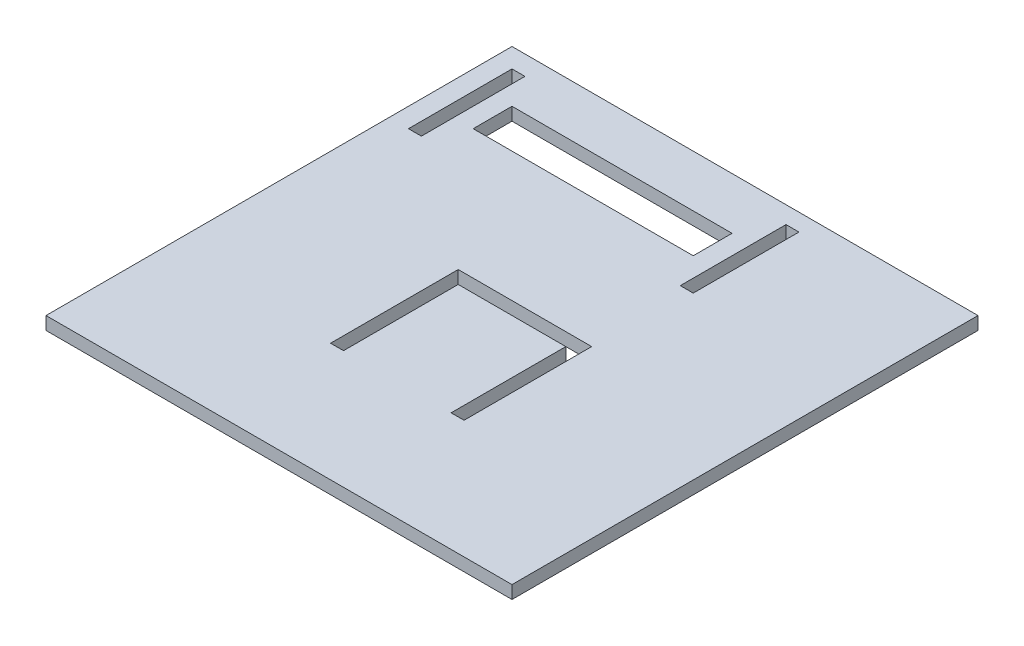
from build123d import *

# Parameters (mm, degrees)
SKETCH1_W           = 114.3
SKETCH1_H           = 114.3
SKETCH1_W_2         = 3.175
SKETCH1_H_2         = 25.4
SKETCH1_W_3         = 53.975
SKETCH1_H_3         = 9.525
SKETCH1_H_4         = 25.936362634
BOSS_EXTRUDE1_DEPTH = 3.175


with BuildPart() as part:
    # Sketch1 → Boss-Extrude1 (new body)
    with BuildSketch(Plane(origin=(0, 0, 0), x_dir=(1, 0, 0), z_dir=(0, 1, 0))):
        Rectangle(SKETCH1_W, SKETCH1_H)
        Polygon((-13.1953, 0), (-13.1953, -28.132309502), (-16.3703, -28.132309502), (-16.3703, 3.175), (-13.1953, 3.175), (13.1953, 3.175), (16.3703, 3.175), (16.3703, -28.132309502), (13.1953, -28.132309502), (13.1953, 0), align=None, mode=Mode.SUBTRACT)
        with Locations((-50.8, 39.6875)):
            Rectangle(SKETCH1_W_2, SKETCH1_H_2, mode=Mode.SUBTRACT)
        with Locations((-17.4625, 39.6875)):
            Rectangle(SKETCH1_W_3, SKETCH1_H_3, mode=Mode.SUBTRACT)
        with Locations((15.875, 39.955681317)):
            Rectangle(SKETCH1_W_2, SKETCH1_H_4, mode=Mode.SUBTRACT)
    extrude(amount=-BOSS_EXTRUDE1_DEPTH)


solid = part.part
